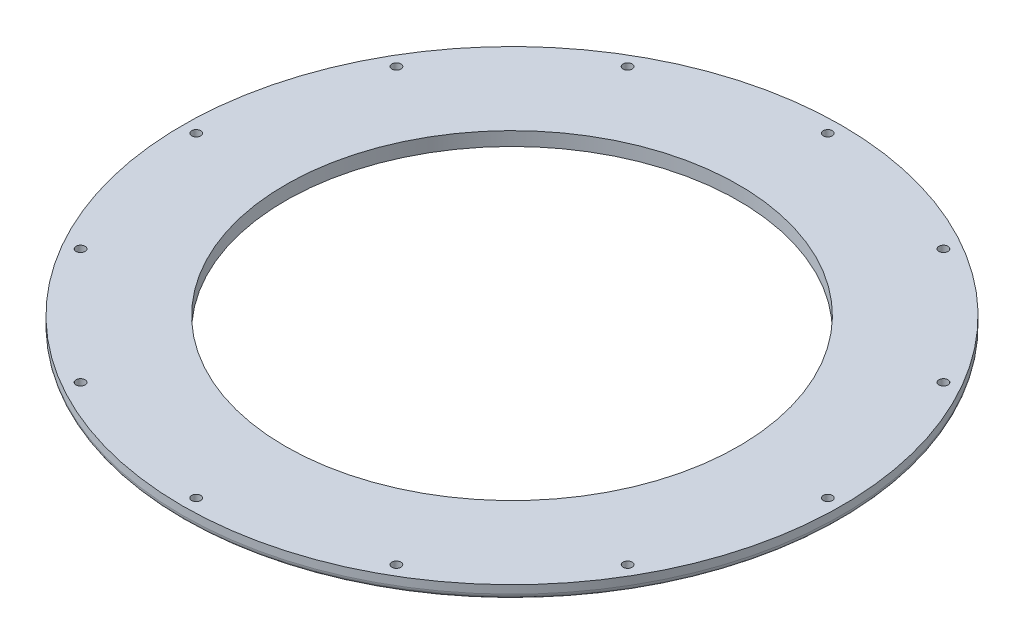
from build123d import *

# Parameters (mm, degrees)
SKETCH_1_R          = 120
SKETCH_1_R_2        = 82.5
EXTRUDE_1_DEPTH     = 5
FILLET_1_R          = 2
SKETCH_2_R          = 1.65
CUT_EXTRUDE_1_DEPTH = 8


with BuildPart() as part:
    # 草图1 → 凸台-拉伸1 (new body)
    with BuildSketch(Plane(origin=(0, 0, 0), x_dir=(1, 0, 0), z_dir=(0, 1, 0))):
        with Locations(Location((0, 0, 0), (0, 0, 270))):
            Circle(SKETCH_1_R)
        with Locations(Location((0, 0, 0), (0, 0, 270))):
            Circle(SKETCH_1_R_2, mode=Mode.SUBTRACT)
    extrude(amount=EXTRUDE_1_DEPTH)

    # 圆角1
    fillet_1_edges = [part.edges().sort_by_distance(p)[0] for p in [
        (0, 0, -120),
    ]]
    fillet(fillet_1_edges, radius=FILLET_1_R)

    # 草图2 → 切除-拉伸1 (cut)
    with BuildSketch(Plane(origin=(0, 0, 0), x_dir=(-1, 0, 0), z_dir=(0, -1, 0))):
        with Locations(Location((0, -115, 0), (0, 0, 90))):
            Circle(SKETCH_2_R)
        with Locations(Location((-57.5, -99.592921435, 0), (0, 0, 90))):
            Circle(SKETCH_2_R)
        with Locations(Location((-99.592921435, -57.5, 0), (0, 0, 90))):
            Circle(SKETCH_2_R)
        with Locations(Location((-115, 0, 0), (0, 0, 90))):
            Circle(SKETCH_2_R)
        with Locations(Location((-99.592921435, 57.5, 0), (0, 0, 90))):
            Circle(SKETCH_2_R)
        with Locations(Location((-57.5, 99.592921435, 0), (0, 0, 90))):
            Circle(SKETCH_2_R)
        with Locations(Location((0, 115, 0), (0, 0, 90))):
            Circle(SKETCH_2_R)
        with Locations(Location((57.5, 99.592921435, 0), (0, 0, 90))):
            Circle(SKETCH_2_R)
        with Locations(Location((99.592921435, 57.5, 0), (0, 0, 90))):
            Circle(SKETCH_2_R)
        with Locations(Location((115, 0, 0), (0, 0, 90))):
            Circle(SKETCH_2_R)
        with Locations(Location((99.592921435, -57.5, 0), (0, 0, 90))):
            Circle(SKETCH_2_R)
        with Locations(Location((57.5, -99.592921435, 0), (0, 0, 90))):
            Circle(SKETCH_2_R)
    extrude(amount=-CUT_EXTRUDE_1_DEPTH, mode=Mode.SUBTRACT)


solid = part.part
